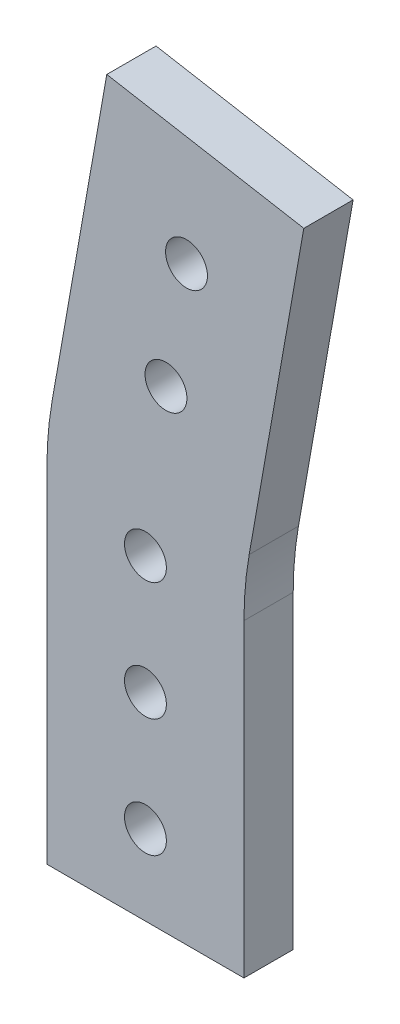
from build123d import *

# Parameters (mm, degrees)
SKETCH_1_R      = 2.125
EXTRUDE_1_DEPTH = 5
FILLET_1_R      = 35


with BuildPart() as part:
    # 草图1 → 凸台-拉伸1 (new body)
    with BuildSketch(Plane.XY):
        Polygon((0, 0), (0, 38), (6.077686218, 72.468271355), (26.077686218, 68.941731741), (20, 34.473460386), (20, 0), align=None)
        with Locations((10, 32.118365096)):
            Circle(SKETCH_1_R, mode=Mode.SUBTRACT)
        with Locations((10, 20.118365096)):
            Circle(SKETCH_1_R, mode=Mode.SUBTRACT)
        with Locations((10, 8.118365096)):
            Circle(SKETCH_1_R, mode=Mode.SUBTRACT)
        with Locations((14.167556264, 59.872116265)):
            Circle(SKETCH_1_R, mode=Mode.SUBTRACT)
        with Locations((12.083778132, 48.054423229)):
            Circle(SKETCH_1_R, mode=Mode.SUBTRACT)
    extrude(amount=EXTRUDE_1_DEPTH)

    # 圆角1
    fillet_1_edges = [part.edges().sort_by_distance(p)[0] for p in [
        (0, 38, 2.5),
        (20, 34.473460386, 2.5),
    ]]
    fillet(fillet_1_edges, radius=FILLET_1_R)


solid = part.part
